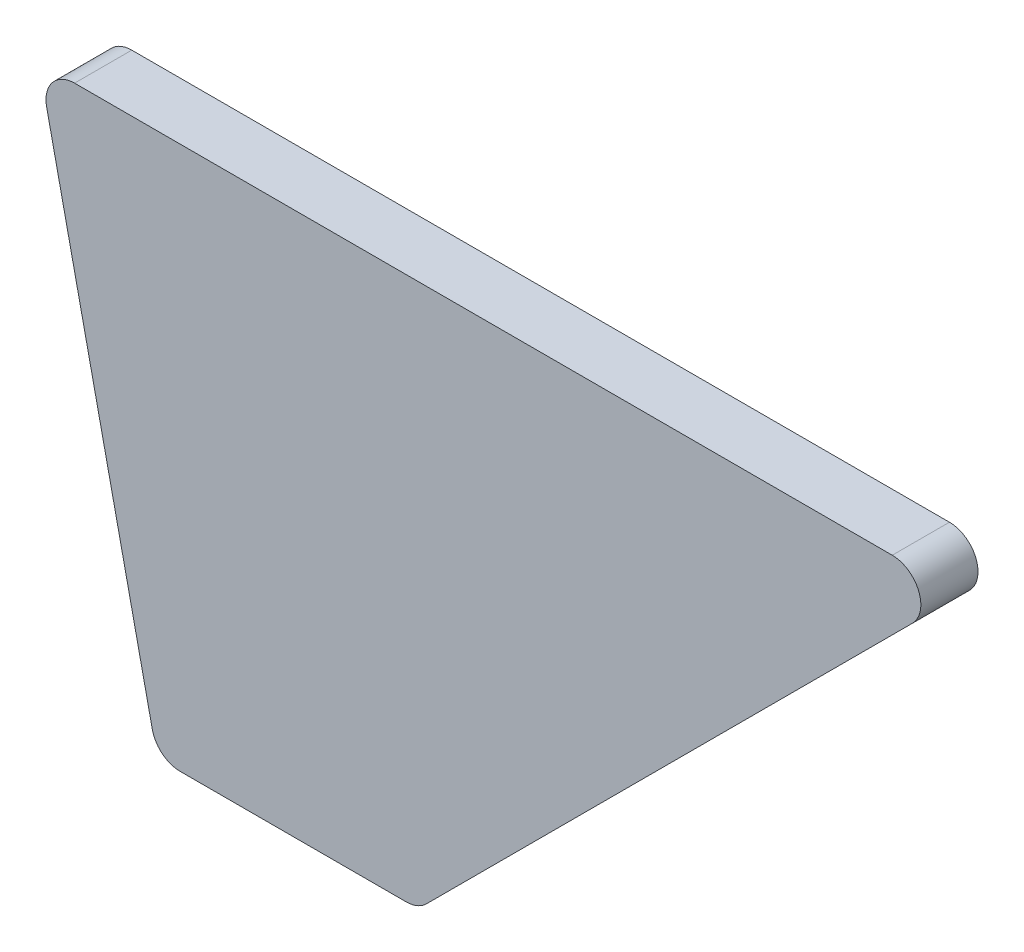
from build123d import *

# Parameters (mm, degrees)
BOSS_EXTRUDE1_DEPTH = 5
FILLET1_R           = 5


with BuildPart() as part:
    # Sketch1 → Boss-Extrude1 (new, symmetric)
    with BuildSketch(Plane.XY):
        Polygon((-12.672945593, -60.23903484), (148.589587107, -60.23903484), (53.589587107, -155.23903484), (7.97922832, -155.23903484), align=None)
    extrude(amount=BOSS_EXTRUDE1_DEPTH, both=True)

    # Fillet1
    fillet1_edges = [part.edges().sort_by_distance(p)[0] for p in [
        (-12.672945593, -60.23903484, 0),
        (148.589587107, -60.23903484, 0),
        (53.589587107, -155.23903484, 0),
        (7.97922832, -155.23903484, 0),
    ]]
    fillet(fillet1_edges, radius=FILLET1_R)


solid = part.part
